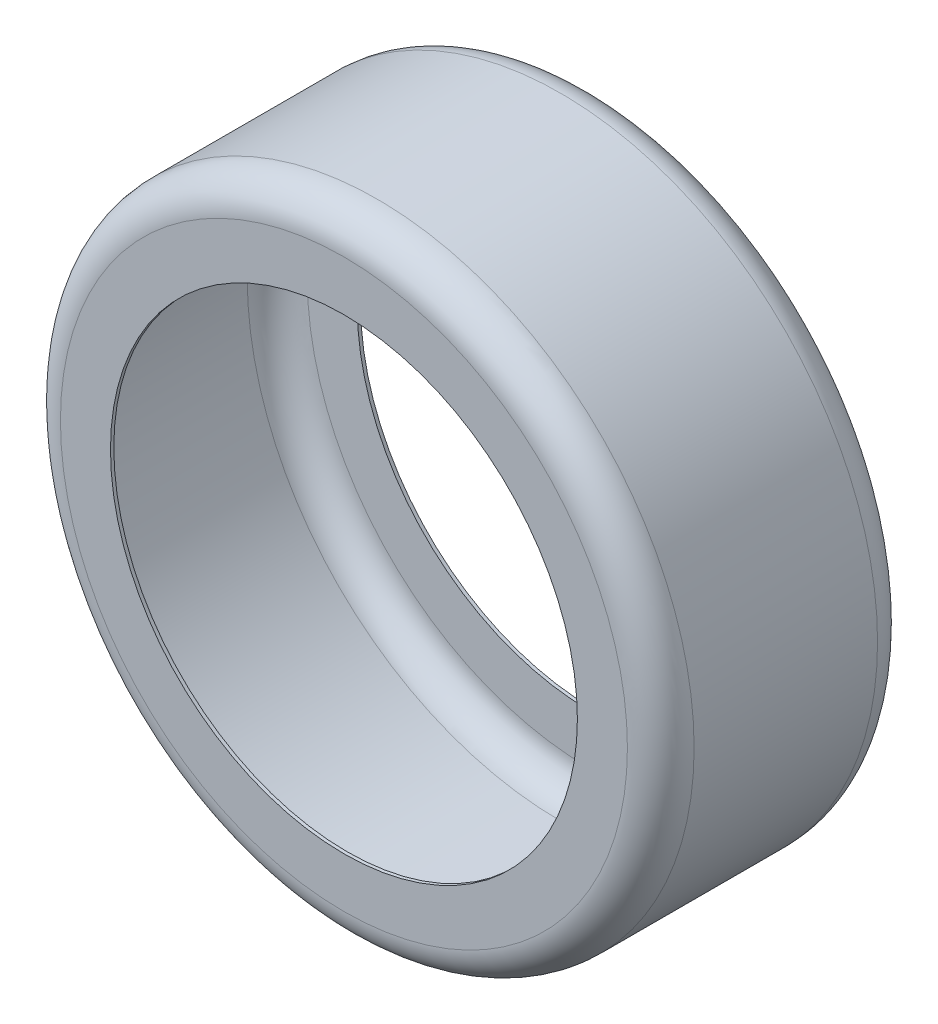
from build123d import *

# Parameters (mm, degrees)
SKETCH1_R           = 190
SKETCH1_R_2         = 140
BOSS_EXTRUDE1_DEPTH = 75
FILLET2_R           = 20
SHELL1_T            = -2


with BuildPart() as part:
    # Sketch1 → Boss-Extrude1 (new, symmetric)
    with BuildSketch(Plane.XY):
        Circle(SKETCH1_R)
        Circle(SKETCH1_R_2, mode=Mode.SUBTRACT)
    extrude(amount=BOSS_EXTRUDE1_DEPTH, both=True)

    # Fillet2
    fillet2_edges = [part.edges().sort_by_distance(p)[0] for p in [
        (-190, 0, -75),
        (-190, 0, 75),
    ]]
    fillet(fillet2_edges, radius=FILLET2_R)

    # Shell1
    shell1_openings = [part.faces().sort_by_distance(p)[0] for p in [
        (-140, 0, 0),
    ]]
    offset(amount=SHELL1_T, openings=shell1_openings, kind=Kind.INTERSECTION)


solid = part.part
